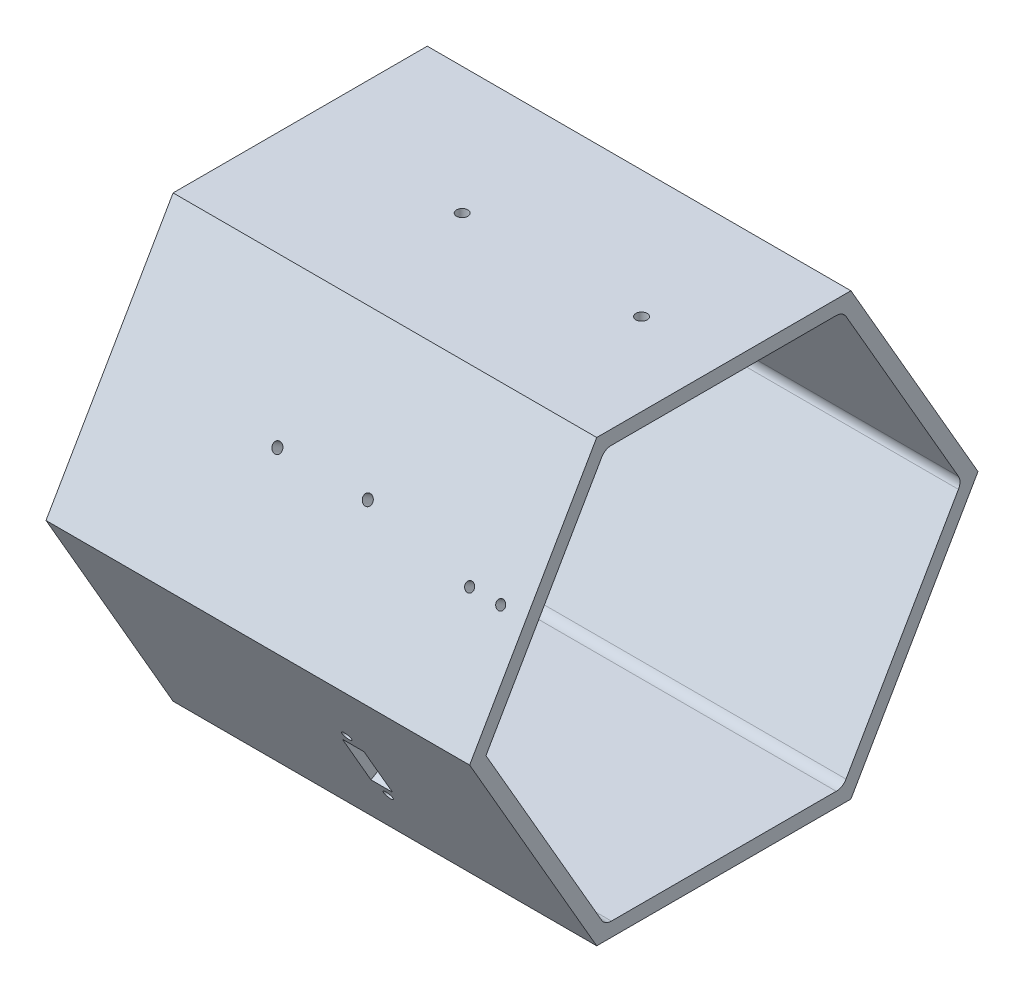
from build123d import *

# Parameters (mm, degrees)
BOSS_EXTRUDE1_DEPTH = 200
CUT_EXTRUDE1_DEPTH  = 195
SKETCH5_R           = 1.65
SKETCH5_W           = 7.65
SKETCH5_H           = 20.2
CUT_EXTRUDE4_DEPTH  = 70
SKETCH7_R           = 4.5
SKETCH7_R_2         = 3
CUT_EXTRUDE6_DEPTH  = 70
FILLET1_R           = 4
CUT_EXTRUDE7_DEPTH  = 70
SKETCH10_R          = 1.6
CUT_EXTRUDE8_DEPTH  = 6
BOSS_EXTRUDE2_DEPTH = 20
SKETCH12_R          = 2
CUT_EXTRUDE9_DEPTH  = 10
SKETCH13_R          = 1.75
CUT_EXTRUDE10_DEPTH = 10


with BuildPart() as part:
    # Sketch1 → Boss-Extrude1 (new body)
    with BuildSketch(Plane(origin=(0, 0, 0), x_dir=(0, 0, -1), z_dir=(1, 0, 0))):
        Polygon((90, 0), (45, 77.942286341), (-45, 77.942286341), (-90, 0), (-45, -77.942286341), (45, -77.942286341), align=None)
    extrude(amount=BOSS_EXTRUDE1_DEPTH)

    # Sketch2 → Cut-Extrude1 (cut)
    with BuildSketch(Plane(origin=(200, 0, 0), x_dir=(0, 0, -1), z_dir=(1, 0, 0))):
        Polygon((84.226497308, 0), (42.113248654, 72.942286341), (-42.113248654, 72.942286341), (-84.226497308, 0), (-42.113248654, -72.942286341), (42.113248654, -72.942286341), align=None)
    extrude(amount=-CUT_EXTRUDE1_DEPTH, mode=Mode.SUBTRACT)

    # Sketch5 → Cut-Extrude4 (cut)
    with BuildSketch(Plane(origin=(0, -38.97114317, 67.5), x_dir=(1, 0, 0), z_dir=(0, -0.500000000000007, 0.8660254037844347))):
        with Locations(Location((68.825, 9.75, 0), (0, 0, 270))):
            Circle(SKETCH5_R)
        with Locations(Location((68.825, -19.75, 0), (0, 0, 270))):
            Circle(SKETCH5_R)
        with Locations((68.825, -5)):
            Rectangle(SKETCH5_W, SKETCH5_H)
    extrude(amount=-CUT_EXTRUDE4_DEPTH, mode=Mode.SUBTRACT)

    # Sketch7 → Cut-Extrude6 (cut)
    with BuildSketch(Plane(origin=(5, 0, 0), x_dir=(0, 0, -1), z_dir=(1, 0, 0))):
        Circle(SKETCH7_R)
        with Locations((60, 0)):
            Circle(SKETCH7_R_2)
        with Locations((30, 51.961524227)):
            Circle(SKETCH7_R_2)
        with Locations((-30, 51.961524227)):
            Circle(SKETCH7_R_2)
        with Locations((-60, 0)):
            Circle(SKETCH7_R_2)
        with Locations((-30, -51.961524227)):
            Circle(SKETCH7_R_2)
        with Locations((30, -51.961524227)):
            Circle(SKETCH7_R_2)
    extrude(amount=-CUT_EXTRUDE6_DEPTH, mode=Mode.SUBTRACT)

    # Fillet1
    fillet1_edges = [part.edges().sort_by_distance(p)[0] for p in [
        (5, -36.47114317, -63.169872981),
        (102.5, 0, -84.226497308),
        (5, -72.942286341, 0),
        (102.5, -72.942286341, -42.113248654),
        (5, -36.47114317, 63.169872981),
        (102.5, -72.942286341, 42.113248654),
        (5, 36.47114317, 63.169872981),
        (5, 72.942286341, 0),
        (102.5, 72.942286341, 42.113248654),
        (5, 36.47114317, -63.169872981),
        (102.5, 72.942286341, -42.113248654),
    ]]
    fillet(fillet1_edges, radius=FILLET1_R)

    # Sketch9 → Cut-Extrude7 (cut)
    with BuildSketch(Plane(origin=(200, 0, 0), x_dir=(0, 0, -1), z_dir=(1, 0, 0))):
        Polygon((45, 77.942286341), (90, 0), (45, -77.942286341), (-45, -77.942286341), (-90, 0), (-45, 77.942286341), align=None)
    extrude(amount=-CUT_EXTRUDE7_DEPTH, mode=Mode.SUBTRACT)

    # Sketch10 → Cut-Extrude8 (cut)
    with BuildSketch(Plane(origin=(0, 38.97114317, 67.5), x_dir=(1, 0, 0), z_dir=(0, 0.49999999999999495, 0.8660254037844417))):
        with Locations(Location((110, -5, 0), (0, 0, 270))):
            Circle(SKETCH10_R)
        with Locations(Location((121, -5, 0), (0, 0, 270))):
            Circle(SKETCH10_R)
    extrude(amount=-CUT_EXTRUDE8_DEPTH, mode=Mode.SUBTRACT)

    # Sketch11 → Boss-Extrude2 (add)
    with BuildSketch(Plane.ZY):
        Polygon((90, 0), (45, 77.942286341), (-45, 77.942286341), (-90, 0), (-45, -77.942286341), (45, -77.942286341), align=None)
        Polygon((84.226497308, 0), (42.113248654, 72.942286341), (-42.113248654, 72.942286341), (-84.226497308, 0), (-42.113248654, -72.942286341), (42.113248654, -72.942286341), align=None, mode=Mode.SUBTRACT)
    extrude(amount=BOSS_EXTRUDE2_DEPTH)

    # Sketch12 → Cut-Extrude9 (cut)
    with BuildSketch(Plane(origin=(0, 77.942286341, 0), x_dir=(1, 0, 0), z_dir=(0, 1, 0))):
        with Locations(Location((100.87, 0, 0), (0, 0, 270))):
            Circle(SKETCH12_R)
        with Locations(Location((37.37, 0, 0), (0, 0, 270))):
            Circle(SKETCH12_R)
    extrude(amount=-CUT_EXTRUDE9_DEPTH, mode=Mode.SUBTRACT)

    # Sketch13 → Cut-Extrude10 (cut)
    with BuildSketch(Plane(origin=(0, 38.97114317, 67.5), x_dir=(1, 0, 0), z_dir=(0, 0.49999999999999983, 0.8660254037844387))):
        with Locations(Location((70.766818174, 1.341454493, 0), (0, 0, 270))):
            Circle(SKETCH13_R)
        with Locations(Location((38.766818174, 1.341454493, 0), (0, 0, 270))):
            Circle(SKETCH13_R)
    extrude(amount=-CUT_EXTRUDE10_DEPTH, mode=Mode.SUBTRACT)


solid = part.part
